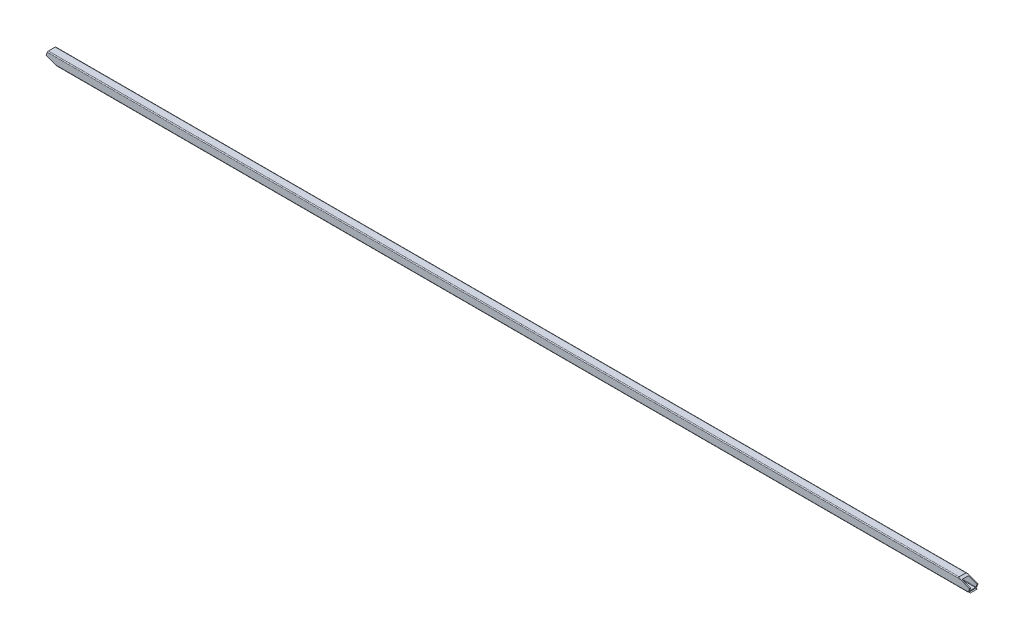
from build123d import *

# Parameters (mm, degrees)
SKETCH3_W           = 25.4
SKETCH3_H           = 25.4
SKETCH3_W_2         = 19.304
SKETCH3_H_2         = 19.304
BOSS_EXTRUDE1_DEPTH = 2786.03
FILLET1_R           = 2.5
FILLET2_R           = 1
CUT_EXTRUDE1_DEPTH  = 2787.174727274


with BuildPart() as part:
    # Sketch3 → Boss-Extrude1 (new body)
    with BuildSketch(Plane(origin=(0, 0, 0), x_dir=(0, 0, -1), z_dir=(1, 0, 0))):
        Rectangle(SKETCH3_W, SKETCH3_H)
        Rectangle(SKETCH3_W_2, SKETCH3_H_2, mode=Mode.SUBTRACT)
    extrude(amount=-BOSS_EXTRUDE1_DEPTH)

    # Fillet1
    fillet1_edges = [part.edges().sort_by_distance(p)[0] for p in [
        (-1393.015, -12.7, -12.7),
        (-1393.015, -12.7, 12.7),
        (-1393.015, 12.7, 12.7),
        (-1393.015, 12.7, -12.7),
    ]]
    fillet(fillet1_edges, radius=FILLET1_R)

    # Fillet2
    fillet2_edges = [part.edges().sort_by_distance(p)[0] for p in [
        (-1393.015, 9.652, -9.652),
        (-1393.015, -9.652, -9.652),
        (-1393.015, -9.652, 9.652),
        (-1393.015, 9.652, 9.652),
    ]]
    fillet(fillet2_edges, radius=FILLET2_R)

    # Sketch4 → Cut-Extrude1 (cut, through all)
    with BuildSketch(Plane.XY.offset(12.7)):
        Polygon((0, 10.2), (-27.238832211, 10.2), (0, 0.015817949), (0, 0.123092977), align=None)
        Polygon((-34.01, 12.731635899), (-27.238832211, 10.2), (0, 10.2), (0, 12.7), (0, 12.731635899), align=None)
        Polygon((0, 0.015817949), (-3.740622532, -10.2), (0, -10.2), align=None)
        Polygon((0, -10.2), (-3.740622532, -10.2), (-4.656022198, -12.7), (0, -12.668364101), align=None)
        Polygon((-2786.03, 12.7), (-2786.03, 10.2), (-2782.222290358, 10.2), (-2781.287578659, 12.7), align=None)
        Polygon((-2786.03, 10.2), (-2786.03, 0.015817949), (-2782.222290358, 10.2), align=None)
        Polygon((-2786.03, 0.015817949), (-2786.03, -10.2), (-2758.706553735, -10.2), align=None)
        Polygon((-2786.03, -10.2), (-2786.03, -12.7), (-2752.02, -12.7), (-2758.706553735, -10.2), align=None)
    extrude(amount=-CUT_EXTRUDE1_DEPTH, mode=Mode.SUBTRACT)


with BuildPart() as cut_extrude1_piece_1:
    # of the separate pieces the step leaves, piece 1, a body of its own (cut_extrude1_pieces)
    add(part.part.solids().sort_by_distance((-3.740622532, -10.2, 12.7))[0])


with BuildPart() as cut_extrude1_piece_2:
    # of the separate pieces the step leaves, piece 2, a body of its own (cut_extrude1_pieces)
    add(part.part.solids().sort_by_distance((0, -12.7, 10.2))[0])


solid = Compound([cut_extrude1_piece_1.part, cut_extrude1_piece_2.part])
